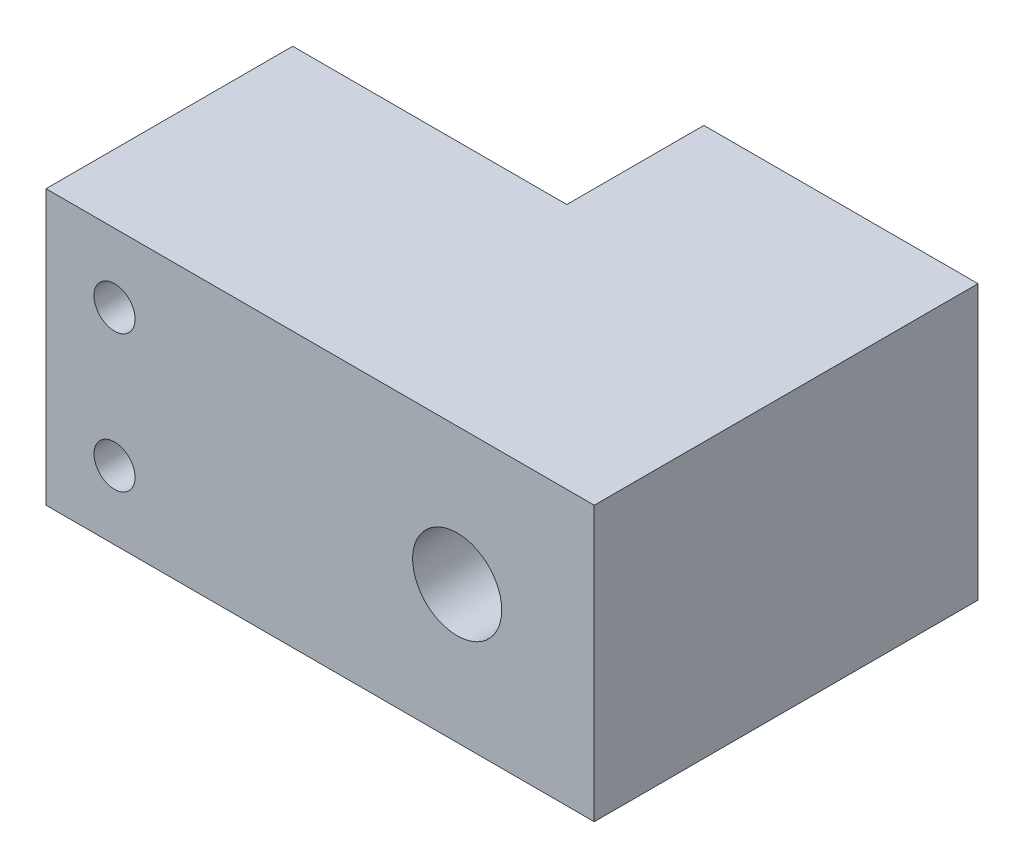
from build123d import *

# Parameters (mm, degrees)
SKETCH1_W           = 40
SKETCH1_H           = 20
BOSS_EXTRUDE1_DEPTH = 18
SKETCH3_W           = 20
SKETCH3_H           = 20
BOSS_EXTRUDE2_DEPTH = 10
SKETCH2_R           = 3.25
SKETCH2_R_2         = 1.5
CUT_EXTRUDE1_DEPTH  = 65


with BuildPart() as part:
    # Sketch1 → Boss-Extrude1 (new body)
    with BuildSketch(Plane.XY):
        with Locations((20, 10)):
            Rectangle(SKETCH1_W, SKETCH1_H)
    extrude(amount=BOSS_EXTRUDE1_DEPTH)

    # Sketch3 → Boss-Extrude2 (add)
    with BuildSketch(Plane(origin=(0, 0, 0), x_dir=(-1, 0, 0), z_dir=(0, 0, -1))):
        with Locations((-30, 10)):
            Rectangle(SKETCH3_W, SKETCH3_H)
    extrude(amount=BOSS_EXTRUDE2_DEPTH)

    # Sketch2 → Cut-Extrude1 (cut)
    with BuildSketch(Plane.XY.offset(18)):
        with Locations((30, 10)):
            Circle(SKETCH2_R)
        with Locations((5, 15)):
            Circle(SKETCH2_R_2)
        with Locations((5, 5)):
            Circle(SKETCH2_R_2)
    extrude(amount=-CUT_EXTRUDE1_DEPTH, mode=Mode.SUBTRACT)


solid = part.part
